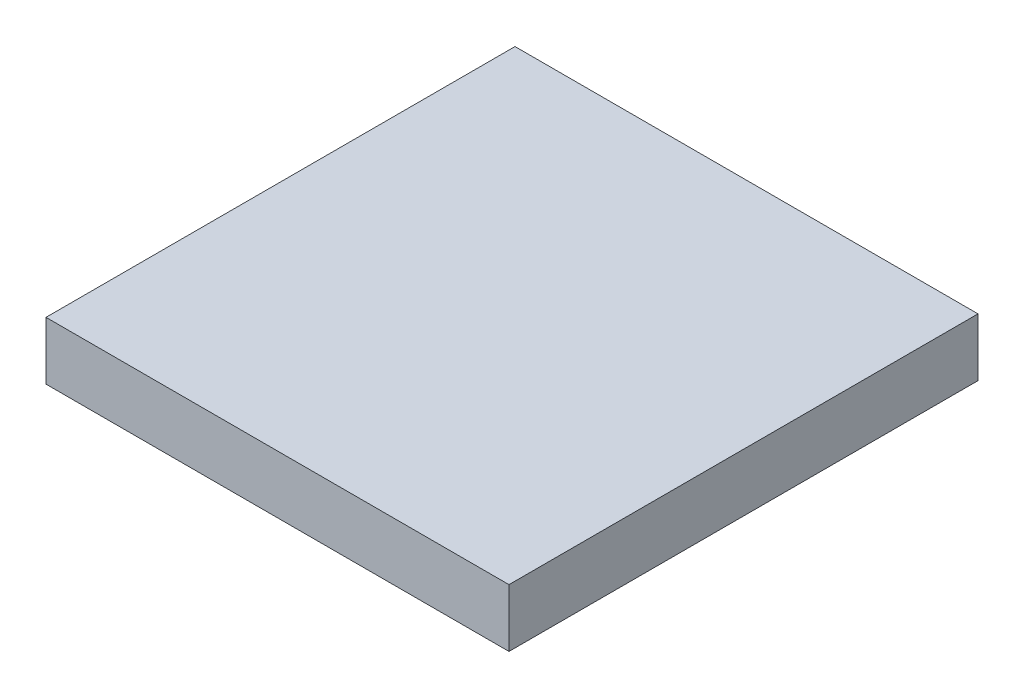
from build123d import *

# Parameters (mm, degrees)
SKETCH1_W           = 25.4
SKETCH1_H           = 25.731304348
BOSS_EXTRUDE1_DEPTH = 3.175


with BuildPart() as part:
    # Sketch1 → Boss-Extrude1 (new body)
    with BuildSketch(Plane(origin=(0, 0, 0), x_dir=(1, 0, 0), z_dir=(0, 1, 0))):
        Rectangle(SKETCH1_W, SKETCH1_H)
    extrude(amount=BOSS_EXTRUDE1_DEPTH)


solid = part.part
